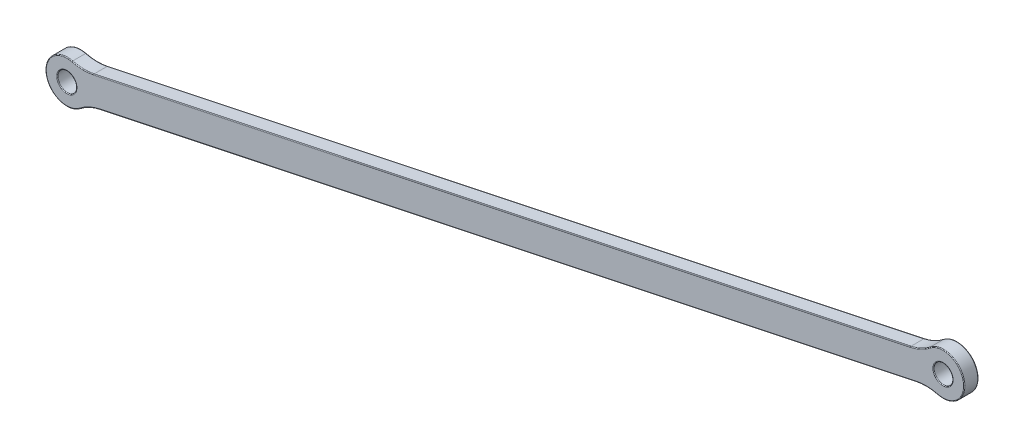
from build123d import *

# Parameters (mm, degrees)
SKETCH1_R           = 2
BOSS_EXTRUDE1_DEPTH = 3
FILLET1_R           = 10
FILLET2_R           = 0.15


with BuildPart() as part:
    # Sketch1 → Boss-Extrude1 (new body)
    with BuildSketch(Plane.XY):
        with BuildLine():
            Line((-207.793622301, 200.771115213), (-28.851162617, 238.573300216))
            ThreePointArc((-28.851162617, 238.573300216), (-20.546586293, 237.261458085), (-27.611013442, 232.702863262))
            Line((-27.611013442, 232.702863262), (-206.553473126, 194.90067826))
            ThreePointArc((-206.553473126, 194.90067826), (-214.85804945, 196.212520391), (-207.793622301, 200.771115213))
        make_face()
        with Locations((-210.455221735, 197.142632272)):
            Circle(SKETCH1_R, mode=Mode.SUBTRACT)
        with Locations((-24.949414008, 236.331346204)):
            Circle(SKETCH1_R, mode=Mode.SUBTRACT)
    extrude(amount=-BOSS_EXTRUDE1_DEPTH)

    # Fillet1
    fillet1_edges = [part.edges().sort_by_distance(p)[0] for p in [
        (-206.553473126, 194.90067826, -1.5),
        (-207.793622301, 200.771115213, -1.5),
        (-28.851162617, 238.573300216, -1.5),
        (-27.611013442, 232.702863262, -1.5),
    ]]
    fillet(fillet1_edges, radius=FILLET1_R)

    # Fillet2
    fillet2_edges = [part.edges().sort_by_distance(p)[0] for p in [
        (-26.949414008, 236.331346204, 0),
        (-212.455221735, 197.142632272, -3),
        (-20.546586293, 237.261458085, 0),
        (-20.546586293, 237.261458085, -3),
        (-118.322392459, 219.672207714, 0),
        (-118.322392459, 219.672207714, -3),
        (-117.082243284, 213.801770761, 0),
        (-117.082243284, 213.801770761, -3),
        (-214.85804945, 196.212520391, 0),
        (-214.85804945, 196.212520391, -3),
        (-29.682396951, 238.665537183, 0),
        (-29.682396951, 238.665537183, -3),
        (-28.333918963, 232.282309123, 0),
        (-28.333918963, 232.282309123, -3),
        (-205.722238791, 194.808441292, 0),
        (-205.722238791, 194.808441292, -3),
        (-207.07071678, 201.191669353, 0),
        (-207.07071678, 201.191669353, -3),
        (-26.949414008, 236.331346204, -3),
        (-212.455221735, 197.142632272, 0),
    ]]
    fillet(fillet2_edges, radius=FILLET2_R)


solid = part.part
